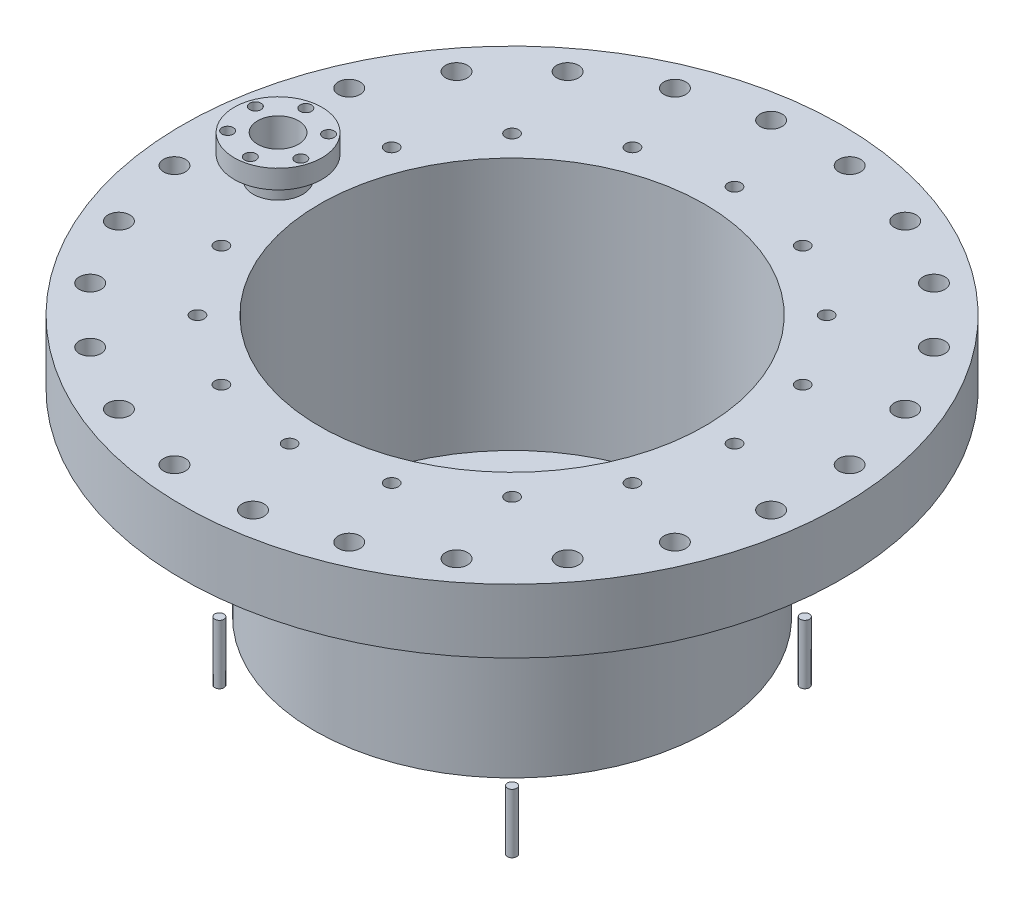
from build123d import *

# Parameters (mm, degrees)
SKETCH1_R               = 76.2
EXTRUDE1_DEPTH          = 75.946
SKETCH2_R               = 127
EXTRUDE2_DEPTH          = 24.638
CUT_EXTRUDE1_DEPTH      = 196.002038236
CUT_EXTRUDE1_DEPTH_BACK = 72.9488
SKETCH3_R               = 74.168
SKETCH4_R               = 48.8061
CUT_EXTRUDE2_DEPTH      = 196.002038236
CIRPATTERN2_COUNT       = 16
SKETCH5_R               = 4.2164
CUT_EXTRUDE5_DEPTH      = 196.002038236
CIRPATTERN3_COUNT       = 24
SKETCH16_R              = 9.525
EXTRUDE3_DEPTH          = 8.636
SKETCH17_R              = 16.891
EXTRUDE5_DEPTH          = 7.239
CUT_EXTRUDE6_DEPTH      = 211.207060776
CUT_EXTRUDE6_DEPTH_BACK = 211.207060776
SKETCH21_R              = 7.874
SKETCH22_R              = 2.1844
CUT_EXTRUDE7_DEPTH      = 7.239
CIRPATTERN4_COUNT       = 6
EXTRUDE_THIN1_START     = 10.0076
SKETCH25_R              = 49.0601
SKETCH25_R_2            = 48.8061
EXTRUDE_THIN1_DEPTH     = 10.0076
SKETCH29_R              = 1.778
EXTRUDE7_DEPTH          = 22.86
EXTRUDE7_2_DEPTH        = 22.86
EXTRUDE7_3_DEPTH        = 22.86
EXTRUDE7_4_DEPTH        = 22.86


with BuildPart() as part:
    # Sketch1 → Extrude1 (new body)
    with BuildSketch(Plane(origin=(0, 0, 0), x_dir=(1, 0, 0), z_dir=(0, 1, 0))):
        with Locations(Location((0, 0, 0), (0, 0, 270))):
            Circle(SKETCH1_R)
    extrude(amount=-EXTRUDE1_DEPTH)

    # Sketch2 → Extrude2 (add)
    with BuildSketch(Plane(origin=(0, 0, 0), x_dir=(1, 0, 0), z_dir=(0, 1, 0))):
        with Locations(Location((0, 0, 0), (0, 0, 90))):
            Circle(SKETCH2_R)
    extrude(amount=EXTRUDE2_DEPTH)

    # Sketch3 → Cut-Extrude1 (cut, two sides: drawn at the far end of the back side and taken through both)
    with BuildSketch(Plane(origin=(0, 0, 0), x_dir=(1, 0, 0), z_dir=(0, 1, 0)).offset(-CUT_EXTRUDE1_DEPTH_BACK)):
        with Locations(Location((0, 0, 0), (0, 0, 90))):
            Circle(SKETCH3_R)
    extrude(amount=CUT_EXTRUDE1_DEPTH + CUT_EXTRUDE1_DEPTH_BACK, mode=Mode.SUBTRACT)

    # Sketch4 → Cut-Extrude2 (cut, through all)
    with BuildSketch(Plane(origin=(0, 0, 0), x_dir=(1, 0, 0), z_dir=(0, 1, 0))):
        with Locations(Location((0, 0, 0), (0, 0, 270))):
            Circle(SKETCH4_R)
    extrude(amount=-CUT_EXTRUDE2_DEPTH, mode=Mode.SUBTRACT)

    # Sketch11 → 1/4-20 Tapped Hole1 (revolve, cut)
    with BuildSketch(Plane(origin=(0, 24.638, -85.725), x_dir=(0, 0, 1), z_dir=(1, 0, 0))):
        Polygon((0, 0), (0, 18.043816902), (2.5527, 16.51), (2.5527, 0), align=None)
    f_1_4_20_tapped_hole1 = revolve(axis=Axis((0, 30.988, -85.725), (0, -1, 0)), mode=Mode.SUBTRACT)

    # CirPattern2: 1/4-20 Tapped Hole1 ×16 about axis, 1 skipped
    cirpattern2_axis = Axis((0, 0, 0), (0, 1, 0))
    add([f_1_4_20_tapped_hole1.rotate(cirpattern2_axis, i * 360 / CIRPATTERN2_COUNT) for i in range(1, CIRPATTERN2_COUNT) if i not in (4,)], mode=Mode.SUBTRACT)

    # Sketch5 → Cut-Extrude5 (cut, through all)
    with BuildSketch(Plane(origin=(0, 0, 0), x_dir=(1, 0, 0), z_dir=(0, 1, 0))):
        with Locations(Location((-15.134642514, 114.959023121, 0), (0, 0, 90))):
            Circle(SKETCH5_R)
    cut_extrude5 = extrude(amount=CUT_EXTRUDE5_DEPTH, mode=Mode.SUBTRACT)

    # CirPattern3: Cut-Extrude5 ×24 about axis
    cirpattern3_axis = Axis((0, 0, 0), (0, 1, 0))
    for i in range(1, CIRPATTERN3_COUNT):
        add(cut_extrude5.rotate(cirpattern3_axis, i * 360 / CIRPATTERN3_COUNT), mode=Mode.SUBTRACT)

    # Sketch16 → Extrude3 (add)
    with BuildSketch(Plane(origin=(0, 24.638, 0), x_dir=(-1, 0, 0), z_dir=(0, 1, 0))):
        with Locations(Location((90.17, 0, 0), (0, 0, 90))):
            Circle(SKETCH16_R)
    extrude(amount=EXTRUDE3_DEPTH)

    # Sketch17 → Extrude5 (add)
    with BuildSketch(Plane(origin=(0, 33.274, 0), x_dir=(-1, 0, 0), z_dir=(0, 1, 0))):
        with Locations(Location((90.17, 0, 0), (0, 0, 90))):
            Circle(SKETCH17_R)
    extrude(amount=EXTRUDE5_DEPTH)

    # Sketch21 → Cut-Extrude6 (cut, two sides: drawn at the far end of the back side and taken through both)
    with BuildSketch(Plane(origin=(0, 33.274, 0), x_dir=(-1, 0, 0), z_dir=(0, 1, 0)).offset(-CUT_EXTRUDE6_DEPTH_BACK)):
        with Locations(Location((90.17, 0, 0), (0, 0, 90))):
            Circle(SKETCH21_R)
    extrude(amount=CUT_EXTRUDE6_DEPTH + CUT_EXTRUDE6_DEPTH_BACK, mode=Mode.SUBTRACT)

    # Sketch22 → Cut-Extrude7 (cut)
    with BuildSketch(Plane(origin=(0, 40.513, 0), x_dir=(-1, 0, 0), z_dir=(0, 1, 0))):
        with Locations(Location((87.376, 13.4874, 0), (0, 0, 90))):
            Circle(SKETCH22_R)
    cut_extrude7 = extrude(amount=-CUT_EXTRUDE7_DEPTH, mode=Mode.SUBTRACT)

    # CirPattern4: Cut-Extrude7 ×6 about axis
    cirpattern4_axis = Axis((-90.17, 0, 0), (0, 1, 0))
    for i in range(1, CIRPATTERN4_COUNT):
        add(cut_extrude7.rotate(cirpattern4_axis, i * 360 / CIRPATTERN4_COUNT), mode=Mode.SUBTRACT)

    # Sketch25 → Extrude-Thin1 (add)
    with BuildSketch(Plane(origin=(0, -72.9488, 0), x_dir=(-1, 0, 0), z_dir=(0, 1, 0)).offset(EXTRUDE_THIN1_START)):
        Circle(SKETCH25_R)
        Circle(SKETCH25_R_2, mode=Mode.SUBTRACT)
    extrude(amount=-EXTRUDE_THIN1_DEPTH)


with BuildPart() as body_2:
    # Sketch29 → Extrude7 (new body)
    with BuildSketch(Plane.XZ.offset(75.946)):
        with Locations((-56.39600844, 56.39600844)):
            Circle(SKETCH29_R)
    extrude(amount=EXTRUDE7_DEPTH)


with BuildPart() as body_3:
    # Sketch29 → Extrude7 2 (new body)
    with BuildSketch(Plane.XZ.offset(75.946)):
        with Locations((-56.39600844, -56.39600844)):
            Circle(SKETCH29_R)
    extrude(amount=EXTRUDE7_2_DEPTH)


with BuildPart() as body_4:
    # Sketch29 → Extrude7 3 (new body)
    with BuildSketch(Plane.XZ.offset(75.946)):
        with Locations((56.39600844, -56.39600844)):
            Circle(SKETCH29_R)
    extrude(amount=EXTRUDE7_3_DEPTH)


with BuildPart() as body_5:
    # Sketch29 → Extrude7 4 (new body)
    with BuildSketch(Plane.XZ.offset(75.946)):
        with Locations((56.39600844, 56.39600844)):
            Circle(SKETCH29_R)
    extrude(amount=EXTRUDE7_4_DEPTH)


solid = Compound([part.part, body_2.part, body_3.part, body_4.part, body_5.part])
